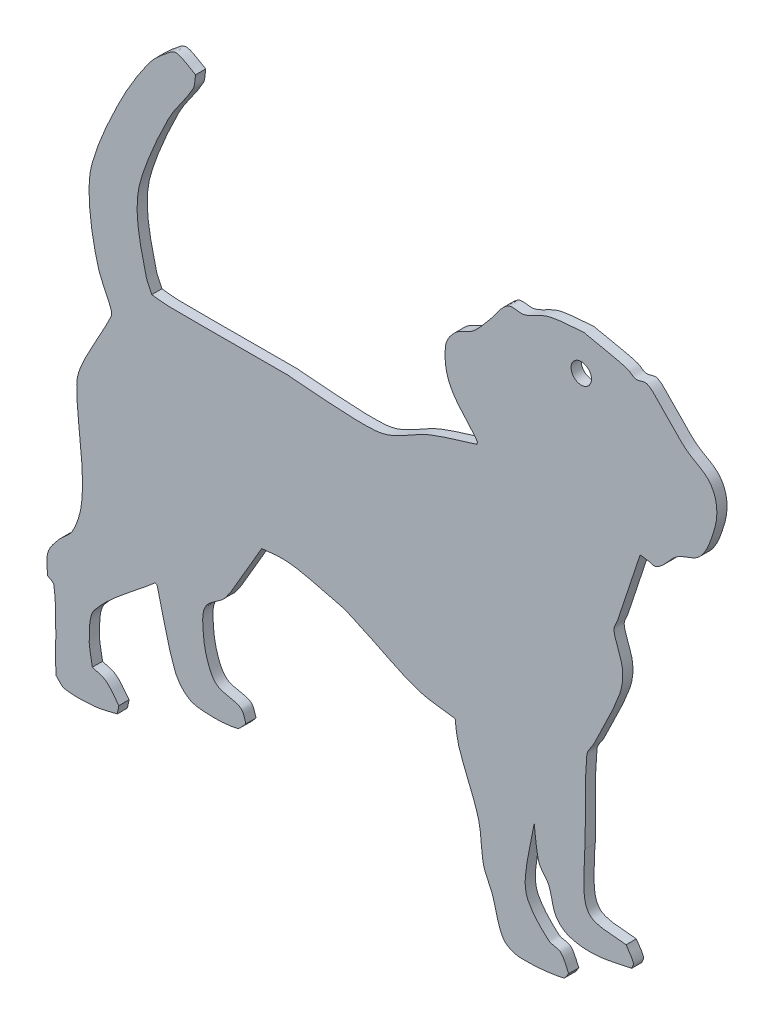
from build123d import *

# Parameters (mm, degrees)
BOSS_EXTRUDE1_DEPTH = 25.4
SKETCH2_R           = 25.4
CUT_EXTRUDE1_DEPTH  = 25.4


with BuildPart() as part:
    # Sketch1 → Boss-Extrude1 (new body)
    with BuildSketch(Plane.XY):
        with BuildLine():
            Line((430, 467), (425, 468))
            add(Edge.make_bspline(
                [(425, 468), (375, 423.666666667), (317.245294413, 386.776244982), (275, 335), (260.369867472, 317.069166841), (262.092108181, 290.116289825), (261, 267), (260.063408395, 247.175477684), (266.333333333, 227.666666667), (269, 208)],
                knots=[0, 0, 0, 0, 1, 1, 1, 2, 2, 2, 3, 3, 3, 3], degree=3))
            add(Edge.make_bspline(
                [(269, 208), (280.333333333, 203.666666667), (293.328469283, 202.32691721), (303, 195), (315.997464074, 185.153436308), (324.333333333, 170.333333333), (335, 158)],
                knots=[0, 0, 0, 0, 1, 1, 1, 2, 2, 2, 2], degree=3))
            Line((335, 158), (331, 138))
            add(Edge.make_bspline(
                [(331, 138), (312, 134), (293.34839613, 127.624674484), (274, 126), (249.41759265, 123.93582839), (224.199511825, 122.210513285), (200, 127), (190.705181473, 128.8395995), (185.333333333, 139), (178, 145)],
                knots=[0, 0, 0, 0, 1, 1, 1, 2, 2, 2, 3, 3, 3, 3], degree=3))
            add(Edge.make_bspline(
                [(178, 145), (177.666666667, 170), (177, 194.997777877), (177, 220), (177, 221.374368542), (178.046959523, 222.626433951), (178, 224), (176.711743359, 261.681506742), (179.198420801, 299.809475197), (173, 337), (171.870276018, 343.778343894), (162.333333333, 345.666666667), (157, 350)],
                knots=[0, 0, 0, 0, 1, 1, 1, 2, 2, 2, 3, 3, 3, 4, 4, 4, 4], degree=3))
            add(Edge.make_bspline(
                [(157, 350), (157.333333333, 366.666666667), (153.325496646, 383.998815441), (158, 400), (162.330055757, 414.822113938), (173.39152622, 426.911920084), (183, 439), (194.150349286, 453.027858779), (211.40897388, 462.274053882), (220, 478), (231.57361055, 499.185592194), (238.988858621, 523.047739034), (242, 547), (246.573714284, 583.381818168), (244.024269227, 620.456746844), (241, 657), (237.111818484, 703.982193318), (229.508955713, 750.85974841), (230, 798), (230.182735883, 815.542644766), (235.797245406, 833.003184566), (243, 849), (264.607830397, 896.98948379), (293.945079638, 941.214339215), (316, 989), (318.239337881, 993.851898743), (316.821752824, 999.976378577), (315, 1005), (305.73381309, 1030.552212388), (290.128888451, 1053.771070795), (283, 1080), (272.349371532, 1119.186274552), (264.839380277, 1159.491508055), (262, 1200), (259.804655174, 1231.320252855), (259.499374524, 1263.775553863), (268, 1294), (283.787044348, 1350.131713236), (308.288529669, 1403.66530507), (334, 1456), (355.426225276, 1499.612245775), (380.500745829, 1541.643887097), (409, 1581), (422.826933404, 1600.094336606), (441.516167034, 1615.366965569), (460, 1630), (465.873079513, 1634.649521281), (473.69553817, 1639.660104961), (481, 1638), (497.426800449, 1634.266636262), (511, 1622.666666667), (526, 1615)],
                knots=[0, 0, 0, 0, 1, 1, 1, 2, 2, 2, 3, 3, 3, 4, 4, 4, 5, 5, 5, 6, 6, 6, 7, 7, 7, 8, 8, 8, 9, 9, 9, 10, 10, 10, 11, 11, 11, 12, 12, 12, 13, 13, 13, 14, 14, 14, 15, 15, 15, 16, 16, 16, 17, 17, 17, 17], degree=3))
            add(Edge.make_bspline(
                [(526, 1615), (524, 1604), (525.184864041, 1591.905411899), (520, 1582), (502.547884903, 1548.658645785), (475.82986763, 1520.65973526), (459, 1487), (432.339167305, 1433.67833461), (407.691368695, 1378.929917211), (390, 1322), (381.446474443, 1294.475193401), (379.166944626, 1264.764868951), (381, 1236), (383.544566142, 1196.069885149), (393.662489228, 1156.906294882), (403, 1118), (405.717122265, 1106.678657228), (412.333333333, 1096.666666667), (417, 1086)],
                knots=[0, 0, 0, 0, 1, 1, 1, 2, 2, 2, 3, 3, 3, 4, 4, 4, 5, 5, 5, 6, 6, 6, 6], degree=3))
            add(Edge.make_bspline(
                [(417, 1086), (430, 1084.666666667), (442.932701795, 1082.15328209), (456, 1082), (556.65974163, 1080.819240567), (657.333870872, 1082.328974278), (758, 1082), (759.374361203, 1081.995508624), (760.627426729, 1081.070224679), (762, 1081), (832.320301814, 1077.402217116), (902.699200078, 1067.039391554), (973, 1071), (1022.642726368, 1073.796773317), (1063.712370625, 1111.842974113), (1110, 1130), (1148.173541006, 1144.974151444), (1188, 1155.333333333), (1227, 1168)],
                knots=[0, 0, 0, 0, 1, 1, 1, 2, 2, 2, 3, 3, 3, 4, 4, 4, 5, 5, 5, 6, 6, 6, 6], degree=3))
            add(Edge.make_bspline(
                [(1227, 1168), (1227.333333333, 1170.333333333), (1229.35845918, 1173.073826536), (1228, 1175), (1206.634585195, 1205.294244873), (1175.930026527, 1229.526779703), (1160, 1263), (1148.716660553, 1286.709295548), (1146.148522853, 1314.898016885), (1149, 1341), (1150.719747877, 1356.742307487), (1161.641189049, 1370.965726505), (1173, 1382), (1185.752878653, 1394.388510692), (1205.289272014, 1397.680678058), (1219, 1409), (1234.285354223, 1421.619304068), (1245.860171875, 1438.159723529), (1259, 1453), (1274.19561261, 1470.162103654), (1284.524059571, 1492.911485251), (1304, 1505), (1315.908441042, 1512.391446164), (1332.484135832, 1503.289762778), (1346, 1507), (1367.019459122, 1512.770047602), (1384.828590118, 1527.815164927), (1406, 1533), (1434.353083759, 1539.943612349), (1463.950783396, 1540.127000556), (1493, 1543), (1494.367695811, 1543.135266619), (1495.655111959, 1542.283134324), (1497, 1542), (1520.989442859, 1536.949590977), (1545.089900571, 1532.413607418), (1569, 1527), (1580.434251521, 1524.411112863), (1592.006142739, 1522.071798985), (1603, 1518), (1610.134837821, 1515.357467474), (1615.49094604, 1508.225967993), (1623, 1507), (1632.591263585, 1505.434079415), (1643.148097565, 1514.011018291), (1652, 1510), (1666.39865359, 1503.475610092), (1675.584400373, 1488.9349428), (1687, 1478), (1707.255888516, 1458.596991001), (1725.496993268, 1437.011065468), (1747, 1419), (1764.64863345, 1404.217383948), (1788.240882053, 1396.782437294), (1804, 1380), (1814.821001174, 1368.476336412), (1821.655052771, 1352.632981526), (1824, 1337), (1826.829291426, 1318.138057157), (1824.531299257, 1298.253287548), (1819, 1280), (1810.999205721, 1253.59737888), (1802.304444793, 1225.641182426), (1784, 1205), (1769.259895861, 1188.378180439), (1743.090086599, 1186.895903318), (1725, 1174), (1709.068891997, 1162.643170532), (1699.085949701, 1144.136426716), (1683, 1133), (1666.135360592, 1121.32448041), (1666.226664561, 1128.426666991), (1656, 1130), (1648.6848623, 1131.1254058), (1641.333333333, 1132), (1634, 1133)],
                knots=[0, 0, 0, 0, 1, 1, 1, 2, 2, 2, 3, 3, 3, 4, 4, 4, 5, 5, 5, 6, 6, 6, 7, 7, 7, 8, 8, 8, 9, 9, 9, 10, 10, 10, 11, 11, 11, 12, 12, 12, 13, 13, 13, 14, 14, 14, 15, 15, 15, 16, 16, 16, 17, 17, 17, 18, 18, 18, 19, 19, 19, 20, 20, 20, 21, 21, 21, 22, 22, 22, 23, 23, 23, 24, 24, 24, 25, 25, 25, 25], degree=3))
            add(Edge.make_bspline(
                [(1634, 1133), (1615.333333333, 1076.666666667), (1596.680456772, 1020.328761958), (1578, 964), (1575.013786044, 954.995416378), (1567.869689192, 946.419256737), (1569, 937), (1572.016777481, 911.860187655), (1587.288888164, 889.174609902), (1590, 864), (1592.049674283, 844.967310233), (1589.519774104, 824.998249639), (1583, 807), (1565.627078753, 759.040949798), (1540.847586233, 714.093078273), (1519, 668), (1513.507517373, 656.412201286), (1502.185279649, 646.768694397), (1501, 634), (1494.744380827, 566.609920728), (1498.634301126, 498.660066623), (1497, 431), (1496.966812372, 429.626032216), (1496.012493743, 428.374311753), (1496, 427), (1495.678801151, 391.668126631), (1490.75863733, 355.942417801), (1496, 321), (1497.97601758, 307.826549466), (1504.88123694, 292.529921008), (1517, 287), (1542.177347587, 275.511307412), (1571.666666667, 278.333333333), (1599, 274)],
                knots=[0, 0, 0, 0, 1, 1, 1, 2, 2, 2, 3, 3, 3, 4, 4, 4, 5, 5, 5, 6, 6, 6, 7, 7, 7, 8, 8, 8, 9, 9, 9, 10, 10, 10, 11, 11, 11, 11], degree=3))
            add(Edge.make_bspline(
                [(1599, 274), (1605, 264), (1613.46406812, 255.112928765), (1617, 244), (1618.471570629, 239.375063737), (1614.333333333, 234.666666667), (1613, 230)],
                knots=[0, 0, 0, 0, 1, 1, 1, 2, 2, 2, 2], degree=3))
            add(Edge.make_bspline(
                [(1613, 230), (1583, 224.666666667), (1553.4191506, 215.766273261), (1523, 214), (1501.244697507, 212.736788887), (1478.6524841, 214.045592089), (1458, 221), (1444.728274443, 225.469050443), (1432.245923705, 235.016356949), (1425, 247), (1414.14515008, 264.95225179), (1414.575785562, 287.85406014), (1406, 307), (1400.104448819, 320.162160775), (1386.342978351, 329.247235222), (1382, 343), (1374.078470493, 368.084843437), (1374, 395), (1370, 421)],
                knots=[0, 0, 0, 0, 1, 1, 1, 2, 2, 2, 3, 3, 3, 4, 4, 4, 5, 5, 5, 6, 6, 6, 6], degree=3))
            add(Edge.make_bspline(
                [(1370, 421), (1362.666666667, 379), (1351.380773666, 337.501154657), (1348, 295), (1346.661607613, 278.174495707), (1348.014260188, 259.86999827), (1356, 245), (1368.076834824, 222.512100672), (1386.67078757, 203.67144572), (1406, 187), (1414.065476855, 180.043526213), (1428.23936469, 183.294997192), (1436, 176), (1446.002241319, 166.59789316), (1449.333333333, 152), (1456, 140)],
                knots=[0, 0, 0, 0, 1, 1, 1, 2, 2, 2, 3, 3, 3, 4, 4, 4, 5, 5, 5, 5], degree=3))
            add(Edge.make_bspline(
                [(1456, 140), (1451.333333333, 134.666666667), (1448.918007194, 125.537334932), (1442, 124), (1408.326655681, 116.517034596), (1373.491296508, 113.510761752), (1339, 114), (1325.718096843, 114.188395789), (1311.83557514, 118.316592173), (1301, 126), (1292.324378266, 132.151804502), (1287.854750366, 143.087784772), (1284, 153), (1276.084054169, 173.355289278), (1273.174998751, 195.37187859), (1266, 216), (1259.816981557, 233.776178024), (1248.387522499, 249.697763291), (1244, 268), (1236.626018245, 298.760038177), (1239.299007149, 331.476533029), (1231, 362), (1219.515399846, 404.239970057), (1199.222750556, 443.601636775), (1185, 485), (1177.947632713, 505.527426209), (1174.802509957, 527.369880514), (1173, 549)],
                knots=[0, 0, 0, 0, 1, 1, 1, 2, 2, 2, 3, 3, 3, 4, 4, 4, 5, 5, 5, 6, 6, 6, 7, 7, 7, 8, 8, 8, 9, 9, 9, 9], degree=3))
            add(Edge.make_bspline(
                [(1173, 549), (1141.666666667, 554.333333333), (1109.152943472, 554.949018843), (1079, 565), (1034.561278146, 579.812907285), (993.859447687, 604.09788461), (951, 623), (928.85305146, 632.767372177), (907.524488459, 645.300234074), (884, 651), (777.665807689, 676.763791089), (763.690139824, 685.026226183), (691, 675)],
                knots=[0, 0, 0, 0, 1, 1, 1, 2, 2, 2, 3, 3, 3, 4, 4, 4, 4], degree=3))
            add(Edge.make_bspline(
                [(691, 675), (672.051304338, 643.166191287), (654.144248932, 610.716591514), (635, 579), (623.387208329, 559.760897381), (613.469907669, 539.193654994), (599, 522), (584.86507439, 505.20438251), (559.599274879, 497.741904941), (550, 478), (540.507560164, 458.477812413), (544.255047855, 434.637406597), (546, 413), (547.624786117, 392.852652144), (552.493170415, 372.767073963), (560, 354), (564.705910525, 342.235223687), (571.270453946, 329.740355854), (582, 323), (598.602958182, 312.569936527), (621.467987083, 315.542153165), (638, 305), (646.169886836, 299.79021709), (647.40136254, 287.996593651), (651, 279), (651.510427662, 277.723930844), (650.971825316, 275.971825316), (650, 275), (643.148398403, 268.148398403), (637.40599621, 258.327256794), (628, 256), (603.677922451, 249.98216638), (578.024746823, 249.759103463), (553, 251), (537.253702207, 251.780808155), (520.015540909, 253.103301151), (507, 262), (492.083905532, 272.195811408), (480.35305985, 288.08600949), (474, 305), (454.324419912, 357.383037897), (444.666666667, 413), (430, 467)],
                knots=[0, 0, 0, 0, 1, 1, 1, 2, 2, 2, 3, 3, 3, 4, 4, 4, 5, 5, 5, 6, 6, 6, 7, 7, 7, 8, 8, 8, 9, 9, 9, 10, 10, 10, 11, 11, 11, 12, 12, 12, 13, 13, 13, 14, 14, 14, 14], degree=3))
        make_face()
    extrude(amount=BOSS_EXTRUDE1_DEPTH)

    # Sketch2 → Cut-Extrude1 (cut)
    with BuildSketch(Plane(origin=(0, 0, 0), x_dir=(-1, 0, 0), z_dir=(0, 0, -1))):
        with Locations((-1487.343146604, 1451.337035473)):
            Circle(SKETCH2_R)
    extrude(amount=-CUT_EXTRUDE1_DEPTH, mode=Mode.SUBTRACT)


solid = part.part
